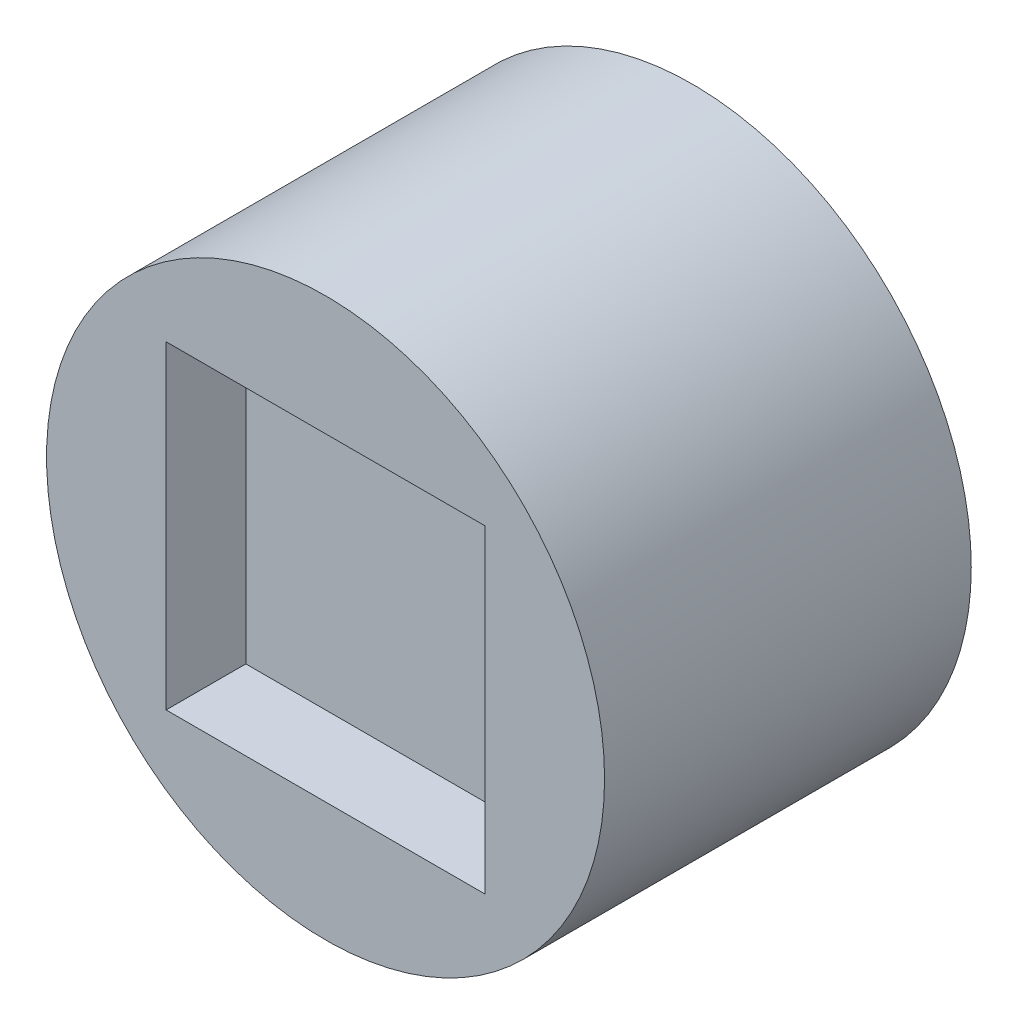
from build123d import *

# Parameters (mm, degrees)
SKETCH1_R           = 0.175
BOSS_EXTRUDE1_DEPTH = 0.23
SKETCH2_W           = 0.2
SKETCH2_H           = 0.2
CUT_EXTRUDE1_DEPTH  = 0.05
SKETCH3_W           = 0.2
SKETCH3_H           = 0.2
CUT_EXTRUDE2_DEPTH  = 0.1


with BuildPart() as part:
    # Sketch1 → Boss-Extrude1 (new body)
    with BuildSketch(Plane.XY):
        Circle(SKETCH1_R)
    extrude(amount=BOSS_EXTRUDE1_DEPTH)

    # Sketch2 → Cut-Extrude1 (cut)
    with BuildSketch(Plane.XY.offset(0.23)):
        Rectangle(SKETCH2_W, SKETCH2_H)
    extrude(amount=-CUT_EXTRUDE1_DEPTH, mode=Mode.SUBTRACT)

    # Sketch3 → Cut-Extrude2 (cut)
    with BuildSketch(Plane(origin=(0, 0, 0), x_dir=(-1, 0, 0), z_dir=(0, 0, -1))):
        Rectangle(SKETCH3_W, SKETCH3_H)
    extrude(amount=-CUT_EXTRUDE2_DEPTH, mode=Mode.SUBTRACT)


solid = part.part
